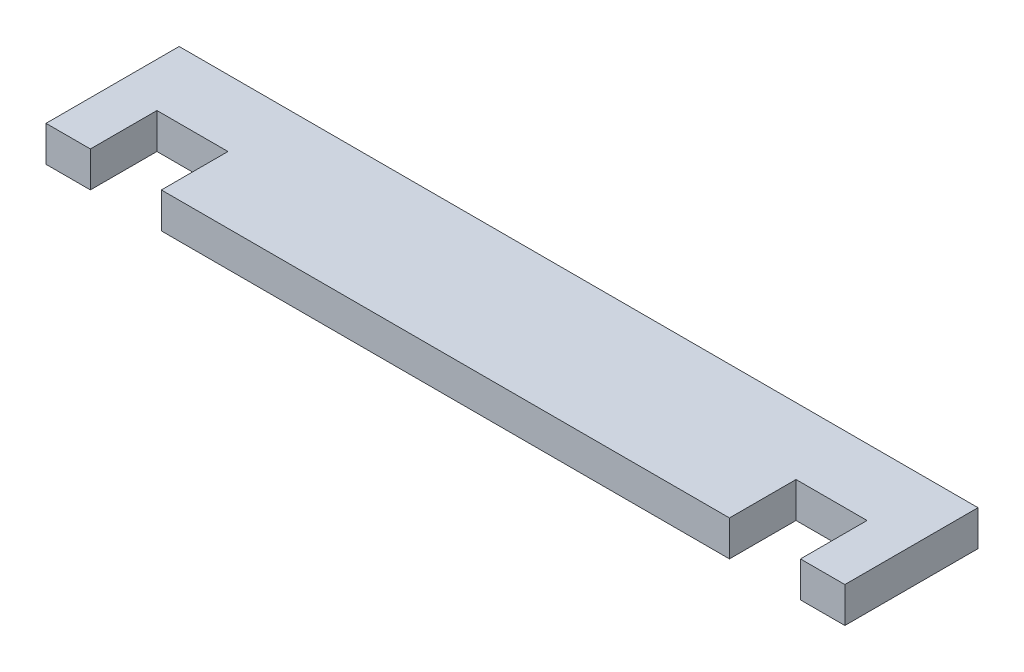
from build123d import *

# Parameters (mm, degrees)
SKETCH1_W           = 180
SKETCH1_H           = 30
BOSS_EXTRUDE1_DEPTH = 8
SKETCH3_W           = 16
SKETCH3_H           = 15
CUT_EXTRUDE1_DEPTH  = 8


with BuildPart() as part:
    # Sketch1 → Boss-Extrude1 (new body)
    with BuildSketch(Plane(origin=(0, 0, 0), x_dir=(1, 0, 0), z_dir=(0, 1, 0))):
        Rectangle(SKETCH1_W, SKETCH1_H)
    extrude(amount=BOSS_EXTRUDE1_DEPTH)

    # Sketch3 → Cut-Extrude1 (cut)
    with BuildSketch(Plane(origin=(0, 8, 0), x_dir=(1, 0, 0), z_dir=(0, 1, 0))):
        with Locations((-72, -7.5)):
            Rectangle(SKETCH3_W, SKETCH3_H)
    cut_extrude1 = extrude(amount=-CUT_EXTRUDE1_DEPTH, mode=Mode.SUBTRACT)

    # Mirror1: Cut-Extrude1 across plane
    add(cut_extrude1.mirror(Plane(origin=(0, 0, 0), x_dir=(0, 0, 1), z_dir=(1, 0, 0))), mode=Mode.SUBTRACT)


solid = part.part
